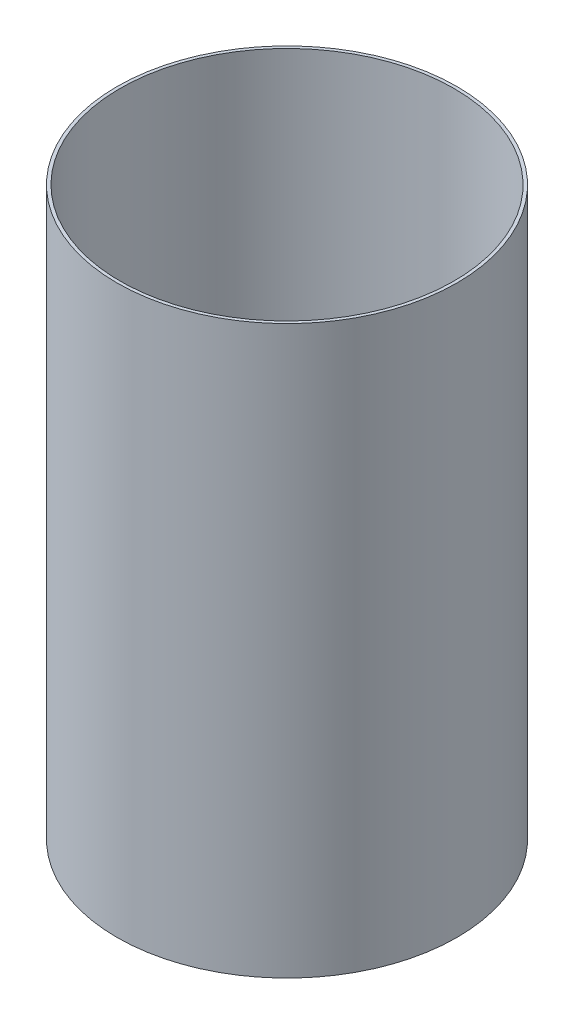
from build123d import *

# Parameters (mm, degrees)
SKETCH1_R           = 69.004198883
SKETCH1_R_2         = 67.734198883
BOSS_EXTRUDE1_DEPTH = 230


with BuildPart() as part:
    # Sketch1 → Boss-Extrude1 (new body)
    with BuildSketch(Plane(origin=(0, -289.999999882, 0), x_dir=(-1, 0, 0), z_dir=(0, -1, 0))):
        with Locations(Location((0, 0, 0), (0, 0, 90))):
            Circle(SKETCH1_R)
        with Locations(Location((0, 0, 0), (0, 0, 90))):
            Circle(SKETCH1_R_2, mode=Mode.SUBTRACT)
    extrude(amount=-BOSS_EXTRUDE1_DEPTH)


solid = part.part
